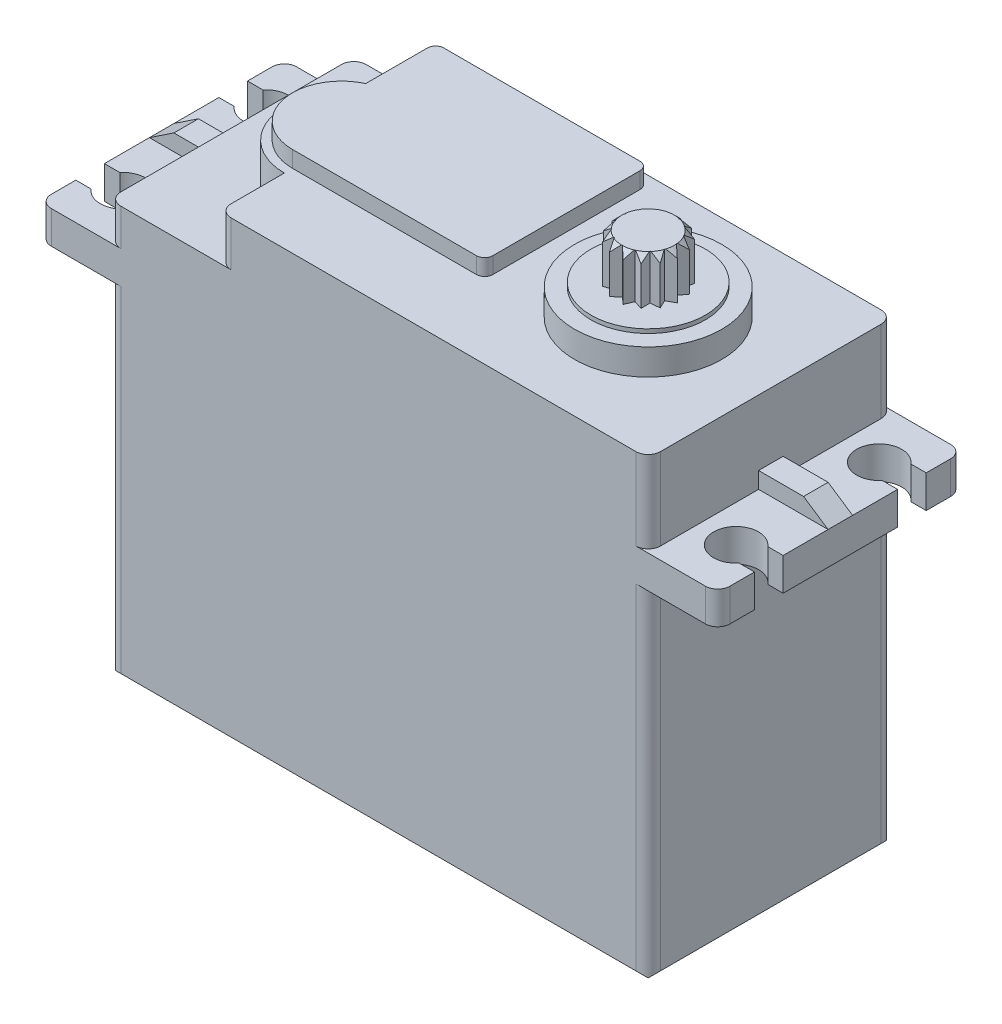
from build123d import *

# Parameters (mm, degrees)
SKETCH1_W            = 66
SKETCH1_H            = 30
BOSS_EXTRUDE1_DEPTH  = 56
CHAMFER1_SIZE        = 1
SKETCH3_W            = 8.5
SKETCH3_H            = 30
BOSS_EXTRUDE2_DEPTH  = 4
CUT_EXTRUDE1_REACH   = 87.86
BOSS_EXTRUDE3_DEPTH  = 1.5
FILLET2_R            = 1.5
FILLET2_OF_MIRROR1_R = 1.5
CUT_EXTRUDE2_DEPTH   = 5.5
FILLET3_R            = 1.5
BOSS_EXTRUDE4_DEPTH  = 2
FILLET4_R            = 1
SKETCH8_R            = 9
BOSS_EXTRUDE5_DEPTH  = 3.2
SKETCH9_R            = 7
BOSS_EXTRUDE6_DEPTH  = 0.5
BOSS_EXTRUDE8_DEPTH  = 5.5
CIRPATTERN1_COUNT    = 15


with BuildPart() as part:
    # Sketch1 → Boss-Extrude1 (new body)
    with BuildSketch(Plane(origin=(0, 0, 0), x_dir=(1, 0, 0), z_dir=(0, 1, 0))):
        with Locations((33, 15)):
            Rectangle(SKETCH1_W, SKETCH1_H)
    extrude(amount=BOSS_EXTRUDE1_DEPTH)

    # Chamfer1
    chamfer1_edges = [part.edges().sort_by_distance(p)[0] for p in [
        (33, 0, -30),
        (66, 0, -15),
        (33, 0, 0),
        (0, 0, -15),
    ]]
    chamfer(chamfer1_edges, length=CHAMFER1_SIZE)

    # Sketch3 → Boss-Extrude2 (add)
    with BuildSketch(Plane(origin=(0, 42, 0), x_dir=(1, 0, 0), z_dir=(0, 1, 0))):
        with Locations((-4.25, 15)):
            Rectangle(SKETCH3_W, SKETCH3_H)
    boss_extrude2 = extrude(amount=BOSS_EXTRUDE2_DEPTH)

    # Sketch4 → Cut-Extrude1 (cut, up to next)
    with BuildSketch(Plane(origin=(0, 46, 0), x_dir=(1, 0, 0), z_dir=(0, 1, 0)), mode=Mode.PRIVATE) as cut_extrude1_sk1:
        with BuildLine():
            Line((-8.5, 8), (-6.621320344, 8))
            ThreePointArc((-6.621320344, 8), (-1.75, 6.25), (-6.621320344, 4.5))
            Line((-6.621320344, 4.5), (-8.5, 4.5))
            Line((-8.5, 4.5), (-8.5, 8))
        make_face()
    cut_extrude1_tool1 = extrude(cut_extrude1_sk1.sketch, amount=-CUT_EXTRUDE1_REACH, mode=Mode.PRIVATE) & part.part
    # Sketch4 → Cut-Extrude1 (cut, up to next)
    with BuildSketch(Plane(origin=(0, 46, 0), x_dir=(1, 0, 0), z_dir=(0, 1, 0)), mode=Mode.PRIVATE) as cut_extrude1_sk2:
        with BuildLine():
            Line((-8.5, 25.5), (-6.621320344, 25.5))
            ThreePointArc((-6.621320344, 25.5), (-1.75, 23.75), (-6.621320344, 22))
            Line((-6.621320344, 22), (-8.5, 22))
            Line((-8.5, 22), (-8.5, 25.5))
        make_face()
    cut_extrude1_tool2 = extrude(cut_extrude1_sk2.sketch, amount=-CUT_EXTRUDE1_REACH, mode=Mode.PRIVATE) & part.part
    cut_extrude1_1 = cut_extrude1_tool1.solids().sort_by_distance((-5.074136, 46, -6.25))[0]
    add(cut_extrude1_1, mode=Mode.SUBTRACT)
    cut_extrude1_2 = cut_extrude1_tool2.solids().sort_by_distance((-5.074136, 46, -23.75))[0]
    add(cut_extrude1_2, mode=Mode.SUBTRACT)
    cut_extrude1 = cut_extrude1_1 + cut_extrude1_2  # Cut-Extrude1 as one shape, for the pattern or mirror that repeats it

    # Sketch5 → Boss-Extrude3 (add, symmetric)
    with BuildSketch(Plane.XY.offset(-15)):
        Polygon((-8.5, 46), (0, 46), (0, 48), (-5.5, 48), align=None)
    boss_extrude3 = extrude(amount=BOSS_EXTRUDE3_DEPTH, both=True)

    # Fillet2
    fillet2_edges = [part.edges().sort_by_distance(p)[0] for p in [
        (-8.5, 44, -30),
        (-8.5, 44, 0),
    ]]
    fillet(fillet2_edges, radius=FILLET2_R)

    # Mirror1: Boss-Extrude2, Cut-Extrude1, Boss-Extrude3 across plane
    add(boss_extrude2.mirror(Plane.ZY.offset(-33)))
    add(cut_extrude1.mirror(Plane.ZY.offset(-33)), mode=Mode.SUBTRACT)
    add(boss_extrude3.mirror(Plane.ZY.offset(-33)))

    # Fillet2 of Mirror1
    fillet2_of_mirror1_edges = [part.edges().sort_by_distance(p)[0] for p in [
        (74.5, 44, -30),
        (74.5, 44, 0),
    ]]
    fillet(fillet2_of_mirror1_edges, radius=FILLET2_OF_MIRROR1_R)

    # Sketch6 → Cut-Extrude2 (cut)
    with BuildSketch(Plane(origin=(0, 56, 0), x_dir=(1, 0, 0), z_dir=(0, 1, 0))):
        with BuildLine():
            Line((13.5, 0), (13.5, 8))
            ThreePointArc((13.5, 8), (6.738519216, 13.188266684), (10, 21.062177826))
            Line((10, 21.062177826), (10, 30))
            Line((10, 30), (0, 30))
            Line((0, 30), (0, 0))
            Line((0, 0), (13.5, 0))
        make_face()
    extrude(amount=-CUT_EXTRUDE2_DEPTH, mode=Mode.SUBTRACT)

    # Fillet3
    fillet3_edges = [part.edges().sort_by_distance(p)[0] for p in [
        (66, 21.5, 0),
        (66, 21.5, -30),
        (0, 48.25, -30),
        (0, 48.25, 0),
        (10, 53.25, -30),
        (13.5, 53.25, 0),
        (0, 21.5, -30),
        (0, 21.5, 0),
        (66, 51, -30),
        (66, 51, 0),
    ]]
    fillet(fillet3_edges, radius=FILLET3_R)

    # Sketch7 → Boss-Extrude4 (add)
    with BuildSketch(Plane(origin=(0, 56, 0), x_dir=(1, 0, 0), z_dir=(0, 1, 0))):
        with BuildLine():
            Line((13.5, 9), (37, 9))
            Line((37, 9), (37, 29))
            Line((37, 29), (11, 29))
            Line((11, 29), (11, 20.454356057))
            ThreePointArc((11, 20.454356057), (7.637997938, 13.720573633), (13.5, 9))
        make_face()
    extrude(amount=BOSS_EXTRUDE4_DEPTH)

    # Fillet4
    fillet4_edges = [part.edges().sort_by_distance(p)[0] for p in [
        (37, 57, -9),
        (37, 57, -29),
        (11, 57, -29),
    ]]
    fillet(fillet4_edges, radius=FILLET4_R)

    # Sketch8 → Boss-Extrude5 (add)
    with BuildSketch(Plane(origin=(0, 56, 0), x_dir=(1, 0, 0), z_dir=(0, 1, 0))):
        with Locations(Location((51, 15, 0), (0, 0, 90))):
            Circle(SKETCH8_R)
    extrude(amount=BOSS_EXTRUDE5_DEPTH)

    # Sketch9 → Boss-Extrude6 (add)
    with BuildSketch(Plane(origin=(0, 59.2, 0), x_dir=(1, 0, 0), z_dir=(0, 1, 0))):
        with Locations(Location((51, 15, 0), (0, 0, 270))):
            Circle(SKETCH9_R)
    extrude(amount=BOSS_EXTRUDE6_DEPTH)

    # Sketch10 → Boss-Extrude8 (add)
    with BuildSketch(Plane(origin=(0, 59.7, 0), x_dir=(1, 0, 0), z_dir=(0, 1, 0))):
        Polygon((50.25, 17.928888995), (51, 19), (51.75, 17.928888995), (51.75, 15), (50.25, 15), align=None)
    boss_extrude8 = extrude(amount=BOSS_EXTRUDE8_DEPTH)

    # CirPattern1: Boss-Extrude8 ×15 about axis
    cirpattern1_axis = Axis((51, 0, -15), (0, 1, 0))
    for i in range(1, CIRPATTERN1_COUNT):
        add(boss_extrude8.rotate(cirpattern1_axis, i * 360 / CIRPATTERN1_COUNT))

    # Sketch13 → Cut-Revolve1 (revolve, cut)
    with BuildSketch(Plane(origin=(51, 0, 0), x_dir=(0, -1, 0), z_dir=(-1, 0, 0))):
        Polygon((-65.2, -18.2), (-65.2, -19), (-64.4, -19), align=None)
    revolve(axis=Axis((51, 66.624672481, -15), (0, -1, 0)), mode=Mode.SUBTRACT)


solid = part.part
